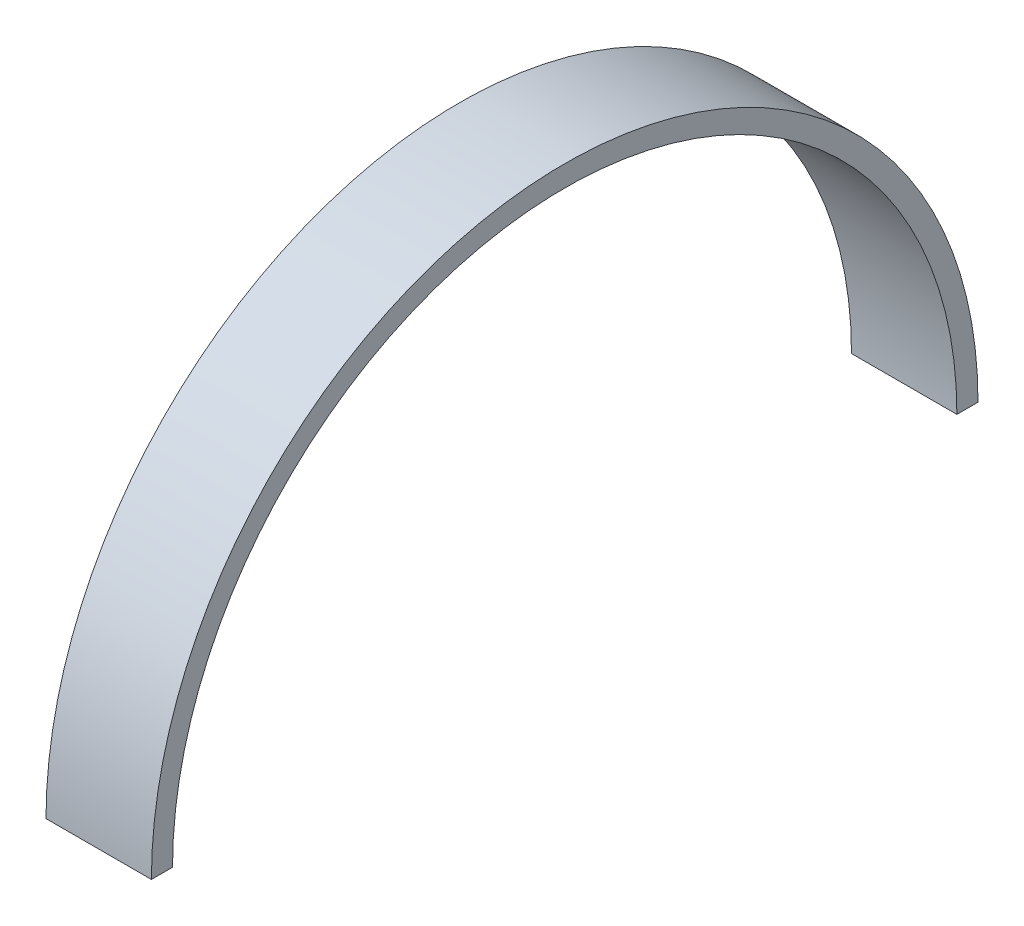
from build123d import *

# Parameters (mm, degrees)
EXTRUDE_1_DEPTH = 10


with BuildPart() as part:
    # Эскиз2 → Бобышка-Вытянуть1 (new body)
    with BuildSketch(Plane(origin=(0, 0, 0), x_dir=(0, 0, -1), z_dir=(1, 0, 0))):
        with BuildLine():
            Line((39.213886817, 0), (37.211475575, 0))
            ThreePointArc((37.211475575, 0), (0, 37.211475575), (-37.211475575, 0))
            Line((-37.211475575, 0), (-39.213886817, 0))
            ThreePointArc((-39.213886817, 0), (0, 39.213886817), (39.213886817, 0))
        make_face()
    extrude(amount=EXTRUDE_1_DEPTH)


solid = part.part
